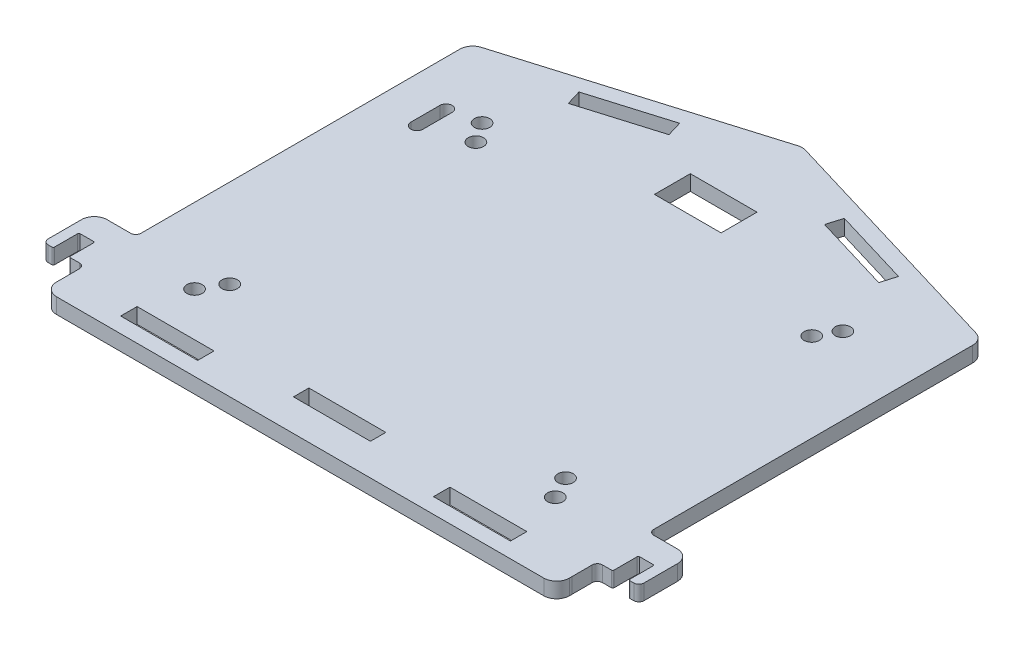
from build123d import *

# Parameters (mm, degrees)
SALIENTE_EXTRUIR1_DEPTH = 3
CROQUIS4_R              = 1.5
CROQUIS4_W              = 15
CROQUIS4_H              = 3.2
CROQUIS4_H_2            = 3
CORTAR_EXTRUIR1_DEPTH   = 3
SALIENTE_EXTRUIR2_DEPTH = 3
REDONDEO1_R             = 1
REDONDEO2_R             = 0.25
CROQUIS6_R              = 1.5
CROQUIS6_W              = 13
CROQUIS6_H              = 7
CORTAR_EXTRUIR2_DEPTH   = 5


with BuildPart() as part:
    # Croquis3 → Saliente-Extruir1 (new body)
    with BuildSketch(Plane(origin=(0, 0, 0), x_dir=(1, 0, 0), z_dir=(0, 1, 0))):
        with BuildLine():
            Line((-50, -40), (50, -40))
            Line((50, -40), (50, -35.05))
            Line((50, -35.05), (53, -35.05))
            Line((53, -35.05), (53, -30.05))
            Line((53, -30.05), (56.1, -30.05))
            Line((56.1, -30.05), (56.1, -35.05))
            Line((56.1, -35.05), (58.1, -35.05))
            Line((58.1, -35.05), (58.1, -27.55))
            ThreePointArc((58.1, -27.55), (57.367766953, -25.782233047), (55.6, -25.05))
            Line((55.6, -25.05), (50, -25.05))
            Line((50, -25.05), (50, 38.139923373))
            ThreePointArc((50, 38.139923373), (49.505732321, 39.632249697), (48.218369714, 40.534489086))
            Line((48.218369714, 40.534489086), (0.718369714, 54.784489086))
            ThreePointArc((0.718369714, 54.784489086), (0, 54.889923373), (-0.718369714, 54.784489086))
            Line((-0.718369714, 54.784489086), (-48.218369714, 40.534489086))
            ThreePointArc((-48.218369714, 40.534489086), (-49.505732321, 39.632249697), (-50, 38.139923373))
            Line((-50, 38.139923373), (-50, -25.05))
            Line((-50, -25.05), (-55.6, -25.05))
            ThreePointArc((-55.6, -25.05), (-57.367766953, -25.782233047), (-58.1, -27.55))
            Line((-58.1, -27.55), (-58.1, -35.05))
            Line((-58.1, -35.05), (-56.1, -35.05))
            Line((-56.1, -35.05), (-56.1, -30.05))
            Line((-56.1, -30.05), (-53, -30.05))
            Line((-53, -30.05), (-53, -35.05))
            Line((-53, -35.05), (-50, -35.05))
            Line((-50, -35.05), (-50, -40))
        make_face()
        Polygon((-31.156326057, 42.52101023), (-16.056326057, 47.05101023), (-15.165547612, 44.081748746), (-30.265547612, 39.551748746), align=None, mode=Mode.SUBTRACT)
        Polygon((15.165547612, 44.081748746), (30.265547612, 39.551748746), (31.156326057, 42.52101023), (16.056326057, 47.05101023), align=None, mode=Mode.SUBTRACT)
    extrude(amount=SALIENTE_EXTRUIR1_DEPTH)

    # Croquis4 → Cortar-Extruir1 (cut, symmetric)
    with BuildSketch(Plane(origin=(0, 3, 0), x_dir=(1, 0, 0), z_dir=(0, 1, 0))):
        with Locations(Location((32.75, 24, 0), (0, 0, 270))):
            Circle(CROQUIS4_R)
        with Locations(Location((-32.736745283, 24, 0), (0, 0, 270))):
            Circle(CROQUIS4_R)
        with Locations(Location((32.75, -24, 0), (0, 0, 270))):
            Circle(CROQUIS4_R)
        with Locations(Location((-32.736745283, -24, 0), (0, 0, 270))):
            Circle(CROQUIS4_R)
        with Locations((-30.5, -38.4)):
            Rectangle(CROQUIS4_W, CROQUIS4_H)
        with Locations((30.5, -38.4)):
            Rectangle(CROQUIS4_W, CROQUIS4_H)
        with Locations((0, -35.3)):
            Rectangle(CROQUIS4_W, CROQUIS4_H_2)
        with BuildLine():
            Line((-40.069692956, 26.698449706), (-40.069692956, 21.030308718))
            ThreePointArc((-40.069692956, 21.030308718), (-41.260824034, 19.839177641), (-42.451955111, 21.030308718))
            Line((-42.451955111, 21.030308718), (-42.451955111, 26.698449706))
            ThreePointArc((-42.451955111, 26.698449706), (-41.260824034, 27.889580784), (-40.069692956, 26.698449706))
        make_face()
    extrude(amount=CORTAR_EXTRUIR1_DEPTH, both=True, mode=Mode.SUBTRACT)

    # Croquis5 → Saliente-Extruir2 (add)
    with BuildSketch(Plane(origin=(0, 0, 0), x_dir=(1, 0, 0), z_dir=(0, 1, 0))):
        with BuildLine():
            Line((-50, -40), (49.999265674, -40))
            Line((49.999265674, -40), (49.999265674, -40.5))
            ThreePointArc((49.999265674, -40.5), (49.267032626, -42.267766953), (47.499265674, -43))
            Line((47.499265674, -43), (-47.5, -43))
            ThreePointArc((-47.5, -43), (-49.267766953, -42.267766953), (-50, -40.5))
            Line((-50, -40.5), (-50, -40))
        make_face()
    extrude(amount=SALIENTE_EXTRUIR2_DEPTH)

    # Redondeo1
    redondeo1_edges = [part.edges().sort_by_distance(p)[0] for p in [
        (-50, 1.5, 35.05),
        (-58.1, 1.5, 35.05),
        (-50, 1.5, 25.05),
        (50, 1.5, 25.05),
        (58.1, 1.5, 35.05),
        (50, 1.5, 35.05),
    ]]
    fillet(redondeo1_edges, radius=REDONDEO1_R)

    # Redondeo2
    redondeo2_edges = [part.edges().sort_by_distance(p)[0] for p in [
        (-53, 1.5, 35.05),
        (-53, 1.5, 30.05),
        (-56.1, 1.5, 30.05),
        (-56.1, 1.5, 35.05),
        (56.1, 1.5, 35.05),
        (56.1, 1.5, 30.05),
        (53, 1.5, 30.05),
        (53, 1.5, 35.05),
    ]]
    fillet(redondeo2_edges, radius=REDONDEO2_R)

    # Croquis6 → Cortar-Extruir2 (cut, symmetric)
    with BuildSketch(Plane(origin=(0, 3, 0), x_dir=(1, 0, 0), z_dir=(0, 1, 0))):
        with Locations(Location((-35.361176909, 27.833892011, 0), (0, 0, 270))):
            Circle(CROQUIS6_R)
        with Locations(Location((34.977904809, 27.833892011, 0), (0, 0, 270))):
            Circle(CROQUIS6_R)
        with Locations(Location((34.977904809, -28.23447772, 0), (0, 0, 270))):
            Circle(CROQUIS6_R)
        with Locations(Location((-35.361176909, -28.23447772, 0), (0, 0, 270))):
            Circle(CROQUIS6_R)
        with Locations((0, 36.081396556)):
            Rectangle(CROQUIS6_W, CROQUIS6_H)
    extrude(amount=CORTAR_EXTRUIR2_DEPTH, both=True, mode=Mode.SUBTRACT)


solid = part.part
